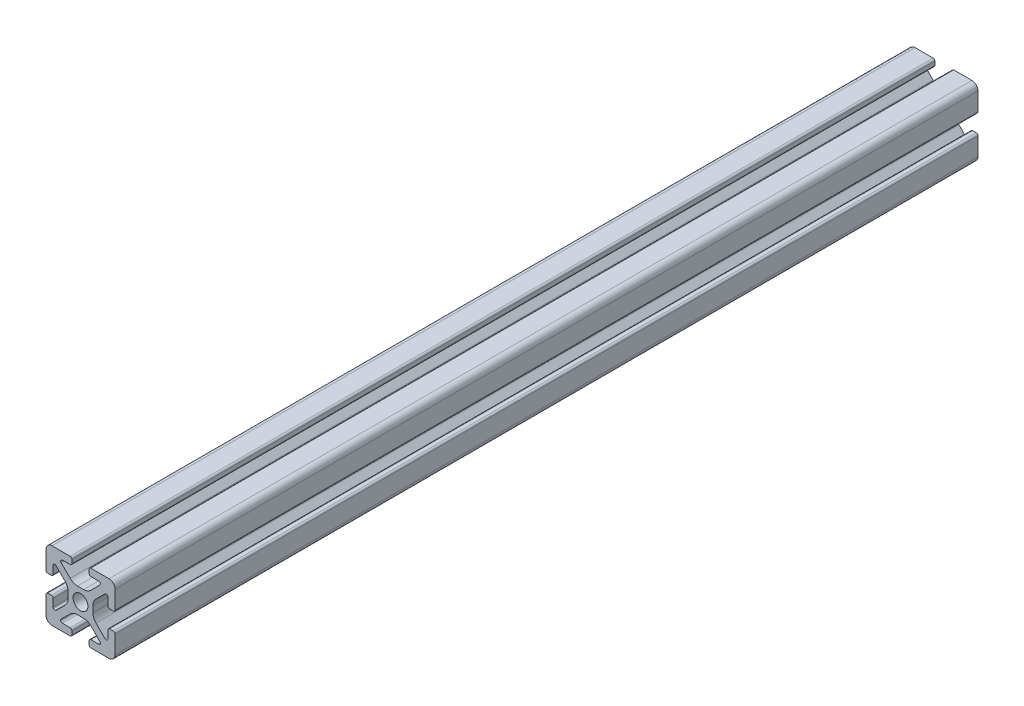
from build123d import *

# Parameters (mm, degrees)
BOSS_EXTRUDE1_DEPTH = 125


with BuildPart() as part:
    # Sketch4 → Boss-Extrude1 (new, symmetric)
    with BuildSketch(Plane.XY):
        with BuildLine():
            Line((3, -10), (8.25, -10))
            ThreePointArc((8.25, -10), (9.487436867, -9.487436867), (10, -8.25))
            Line((10, -8.25), (10, -3))
            ThreePointArc((10, -3), (9.853553391, -2.646446609), (9.5, -2.5))
            Line((9.5, -2.5), (8.424621202, -2.5))
            ThreePointArc((8.424621202, -2.5), (8.071067812, -2.646446609), (7.924621202, -3))
            Line((7.924621202, -3), (7.924621202, -5.25))
            ThreePointArc((7.924621202, -5.25), (7.615962919, -5.711939766), (7.071067812, -5.603553391))
            Line((7.071067812, -5.603553391), (4.478679656, -3.011165235))
            ThreePointArc((4.478679656, -3.011165235), (3.828361402, -2.037895189), (3.6, -0.889844892))
            Line((3.6, -0.889844892), (3.6, 0))
            Line((3.6, 0), (2.15, 0))
            ThreePointArc((2.15, 0), (1.52027958, -1.52027958), (0, -2.15))
            Line((0, -2.15), (0, -3.6))
            Line((0, -3.6), (0.889844892, -3.6))
            ThreePointArc((0.889844892, -3.6), (2.037895189, -3.828361402), (3.011165235, -4.478679656))
            Line((3.011165235, -4.478679656), (5.603553391, -7.071067812))
            ThreePointArc((5.603553391, -7.071067812), (5.711939766, -7.615962919), (5.25, -7.924621202))
            Line((5.25, -7.924621202), (3, -7.924621202))
            ThreePointArc((3, -7.924621202), (2.646446609, -8.071067812), (2.5, -8.424621202))
            Line((2.5, -8.424621202), (2.5, -9.5))
            ThreePointArc((2.5, -9.5), (2.646446609, -9.853553391), (3, -10))
        make_face()
    extrude(amount=BOSS_EXTRUDE1_DEPTH, both=True)

    # Mirror1: part across plane


with BuildPart() as part_1:
    add(part.part)
    add(part.part.mirror(Plane(origin=(0, 0, 0), x_dir=(0, 0, 1), z_dir=(1, 0, 0))))

    # Mirror2: part across plane


with BuildPart() as part_2:
    add(part_1.part)
    add(part_1.part.mirror(Plane.ZX))


solid = part_2.part
